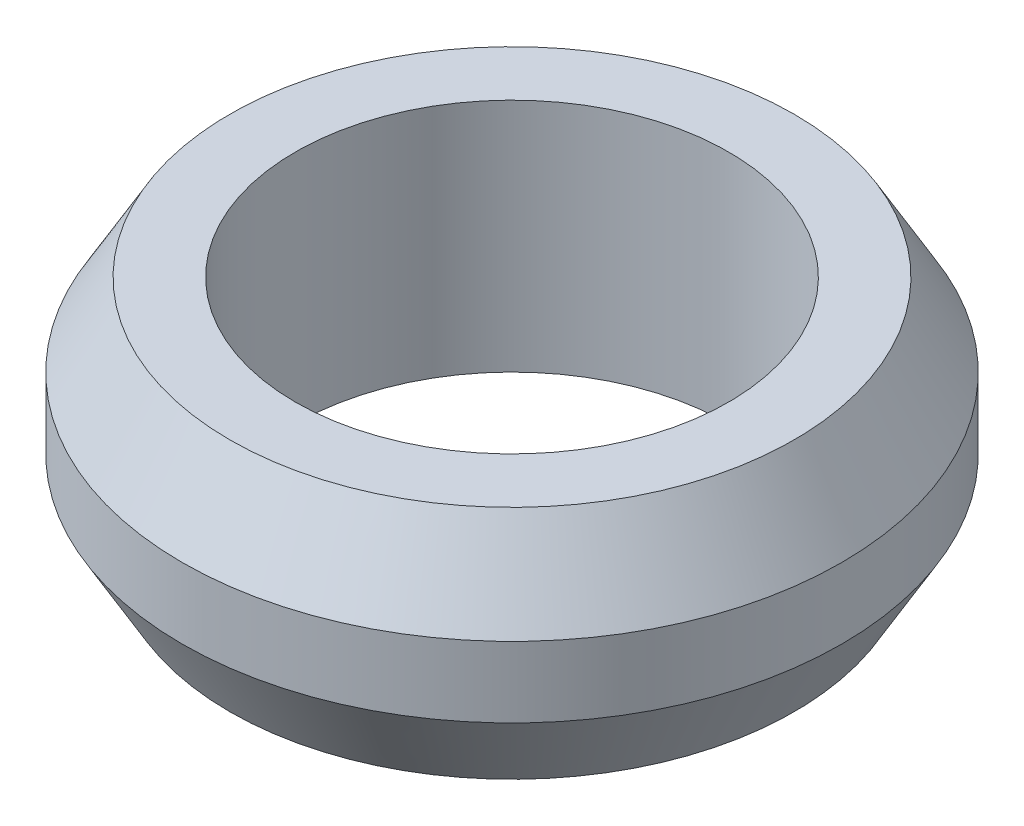
from build123d import *


with BuildPart() as part:
    # 草图2 → 旋转1 (revolve)
    with BuildSketch(Plane.XY, mode=Mode.PRIVATE) as revolve_1_sk:
        Polygon((-5.989637029, 0), (-7, 1.75), (-7, 3.25), (-5.989637029, 5), (-4.6, 5), (-4.6, 0), align=None)
    revolve(revolve_1_sk.sketch.rotate(Axis((0, 6.368637626, 0), (0, -1, 0)), 270), axis=Axis((0, 6.368637626, 0), (0, -1, 0)))


solid = part.part
